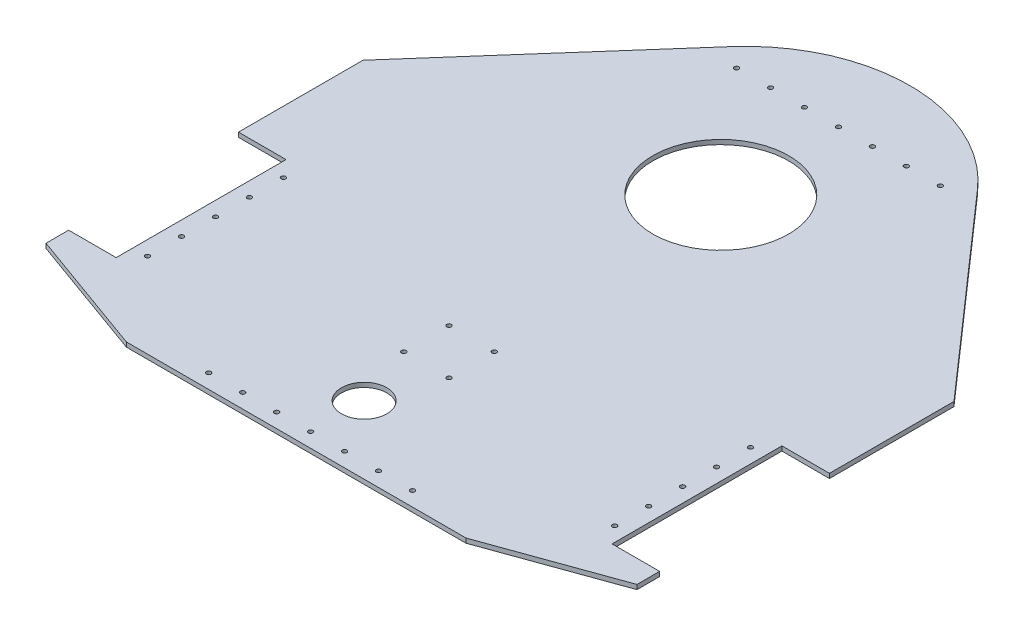
from build123d import *

# Parameters (mm, degrees)
SKETCH1_R           = 60
BOSS_EXTRUDE1_DEPTH = 4
SKETCH2_R           = 2
SKETCH2_R_2         = 20
CUT_EXTRUDE1_DEPTH  = 4
SKETCH3_R           = 2
CUT_EXTRUDE2_DEPTH  = 4
SKETCH4_R           = 2
CUT_EXTRUDE3_DEPTH  = 4


with BuildPart() as part:
    # Sketch1 → Boss-Extrude1 (new body)
    with BuildSketch(Plane(origin=(0, 0, 0), x_dir=(1, 0, 0), z_dir=(0, 1, 0))):
        with BuildLine():
            Line((-219, 50), (-219, -100))
            Line((-219, -100), (-261, -100))
            Line((-261, -100), (-261, -120))
            Line((-261, -120), (-150, -160))
            Line((-150, -160), (150, -160))
            Line((150, -160), (261, -120))
            Line((261, -120), (261, -100))
            Line((261, -100), (219, -100))
            Line((219, -100), (219, 50))
            Line((219, 50), (261, 50))
            Line((261, 50), (261, 160))
            Line((261, 160), (110, 331.658711753))
            ThreePointArc((110, 331.658711753), (0, 382.155640476), (-110, 331.658711753))
            Line((-110, 331.658711753), (-261, 160))
            Line((-261, 160), (-261, 50))
            Line((-261, 50), (-219, 50))
        make_face()
        with Locations(Location((0, 215, 0), (0, 0, 270))):
            Circle(SKETCH1_R, mode=Mode.SUBTRACT)
    extrude(amount=BOSS_EXTRUDE1_DEPTH)

    # Sketch2 → Cut-Extrude1 (cut)
    with BuildSketch(Plane(origin=(0, 4, 0), x_dir=(1, 0, 0), z_dir=(0, 1, 0))):
        with Locations(Location((-206.3, -25, 0), (0, 0, 270))):
            Circle(SKETCH2_R)
        with Locations(Location((-206.3, 5, 0), (0, 0, 270))):
            Circle(SKETCH2_R)
        with Locations(Location((-206.3, 35, 0), (0, 0, 270))):
            Circle(SKETCH2_R)
        with Locations(Location((-206.3, -55, 0), (0, 0, 270))):
            Circle(SKETCH2_R)
        with Locations(Location((-206.3, -85, 0), (0, 0, 270))):
            Circle(SKETCH2_R)
        with Locations(Location((206.3, -85, 0), (0, 0, 270))):
            Circle(SKETCH2_R)
        with Locations(Location((206.3, -55, 0), (0, 0, 270))):
            Circle(SKETCH2_R)
        with Locations(Location((206.3, 5, 0), (0, 0, 270))):
            Circle(SKETCH2_R)
        with Locations(Location((206.3, 35, 0), (0, 0, 270))):
            Circle(SKETCH2_R)
        with Locations(Location((206.3, -25, 0), (0, 0, 270))):
            Circle(SKETCH2_R)
        with Locations(Location((0, -100, 0), (0, 0, 270))):
            Circle(SKETCH2_R_2)
    extrude(amount=-CUT_EXTRUDE1_DEPTH, mode=Mode.SUBTRACT)

    # Sketch3 → Cut-Extrude2 (cut)
    with BuildSketch(Plane(origin=(0, 4, 0), x_dir=(1, 0, 0), z_dir=(0, 1, 0))):
        with Locations(Location((0, 318.958711753, 0), (0, 0, 270))):
            Circle(SKETCH3_R)
        with Locations(Location((30, 318.958711753, 0), (0, 0, 270))):
            Circle(SKETCH3_R)
        with Locations(Location((60, 318.958711753, 0), (0, 0, 270))):
            Circle(SKETCH3_R)
        with Locations(Location((90, 318.958711753, 0), (0, 0, 270))):
            Circle(SKETCH3_R)
        with Locations(Location((-30, 318.958711753, 0), (0, 0, 270))):
            Circle(SKETCH3_R)
        with Locations(Location((-60, 318.958711753, 0), (0, 0, 270))):
            Circle(SKETCH3_R)
        with Locations(Location((-90, 318.958711753, 0), (0, 0, 270))):
            Circle(SKETCH3_R)
        with Locations(Location((0, -147.3, 0), (0, 0, 270))):
            Circle(SKETCH3_R)
        with Locations(Location((30, -147.3, 0), (0, 0, 270))):
            Circle(SKETCH3_R)
        with Locations(Location((60, -147.3, 0), (0, 0, 270))):
            Circle(SKETCH3_R)
        with Locations(Location((90, -147.3, 0), (0, 0, 270))):
            Circle(SKETCH3_R)
        with Locations(Location((-30, -147.3, 0), (0, 0, 270))):
            Circle(SKETCH3_R)
        with Locations(Location((-60, -147.3, 0), (0, 0, 270))):
            Circle(SKETCH3_R)
        with Locations(Location((-90, -147.3, 0), (0, 0, 270))):
            Circle(SKETCH3_R)
    extrude(amount=-CUT_EXTRUDE2_DEPTH, mode=Mode.SUBTRACT)

    # Sketch4 → Cut-Extrude3 (cut)
    with BuildSketch(Plane(origin=(0, 4, 0), x_dir=(1, 0, 0), z_dir=(0, 1, 0))):
        with Locations(Location((-20, -5, 0), (0, 0, 270))):
            Circle(SKETCH4_R)
        with Locations(Location((20, -5, 0), (0, 0, 270))):
            Circle(SKETCH4_R)
        with Locations(Location((20, -45, 0), (0, 0, 270))):
            Circle(SKETCH4_R)
        with Locations(Location((-20, -45, 0), (0, 0, 270))):
            Circle(SKETCH4_R)
    extrude(amount=-CUT_EXTRUDE3_DEPTH, mode=Mode.SUBTRACT)


solid = part.part
